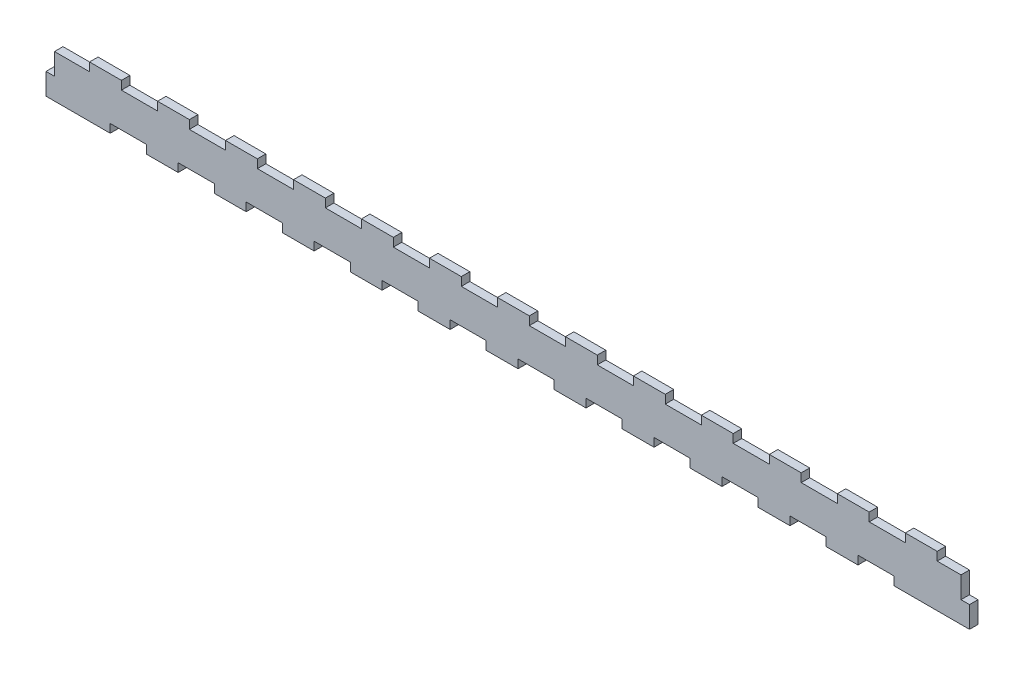
from build123d import *

# Parameters (mm, degrees)
ESQUISSE1_W             = 217.36
ESQUISSE1_H             = 12.11
BOSS_EXTRU_1_DEPTH      = 2
ESQUISSE2_W             = 8.5
ESQUISSE2_H             = 2.25
ESQUISSE2_W_2           = 10.5
ENL_V_MAT_EXTRU_1_DEPTH = 109.866916118
ESQUISSE4_W             = 2
ESQUISSE4_H             = 5.055
ENL_V_MAT_EXTRU_2_DEPTH = 109.866916118


with BuildPart() as part:
    # Esquisse1 → Boss.-Extru.1 (new body)
    with BuildSketch(Plane.XY):
        Rectangle(ESQUISSE1_W, ESQUISSE1_H)
    extrude(amount=BOSS_EXTRU_1_DEPTH)

    # Esquisse2 → Enlèv. mat.-Extru.1 (cut, through all)
    with BuildSketch(Plane(origin=(0, 0, 0), x_dir=(-1, 0, 0), z_dir=(0, 0, -1))):
        with Locations((-105.32, 5.18)):
            Rectangle(ESQUISSE2_W, ESQUISSE2_H)
        with Locations((-89.32, 5.18)):
            Rectangle(ESQUISSE2_W, ESQUISSE2_H)
        with Locations((-73.32, 5.18)):
            Rectangle(ESQUISSE2_W, ESQUISSE2_H)
        with Locations((-57.32, 5.18)):
            Rectangle(ESQUISSE2_W, ESQUISSE2_H)
        with Locations((-41.32, 5.18)):
            Rectangle(ESQUISSE2_W, ESQUISSE2_H)
        with Locations((-25.32, 5.18)):
            Rectangle(ESQUISSE2_W, ESQUISSE2_H)
        with Locations((-9.32, 5.18)):
            Rectangle(ESQUISSE2_W, ESQUISSE2_H)
        with Locations((6.68, 5.18)):
            Rectangle(ESQUISSE2_W, ESQUISSE2_H)
        with Locations((22.68, 5.18)):
            Rectangle(ESQUISSE2_W, ESQUISSE2_H)
        with Locations((38.68, 5.18)):
            Rectangle(ESQUISSE2_W, ESQUISSE2_H)
        with Locations((54.68, 5.18)):
            Rectangle(ESQUISSE2_W, ESQUISSE2_H)
        with Locations((70.68, 5.18)):
            Rectangle(ESQUISSE2_W, ESQUISSE2_H)
        with Locations((86.68, 5.18)):
            Rectangle(ESQUISSE2_W, ESQUISSE2_H)
        with Locations((103.68, 5.18)):
            Rectangle(ESQUISSE2_W_2, ESQUISSE2_H)
        with Locations((-86.68, -5.18)):
            Rectangle(ESQUISSE2_W, ESQUISSE2_H)
        with Locations((-70.68, -5.18)):
            Rectangle(ESQUISSE2_W, ESQUISSE2_H)
        with Locations((-54.68, -5.18)):
            Rectangle(ESQUISSE2_W, ESQUISSE2_H)
        with Locations((-38.68, -5.18)):
            Rectangle(ESQUISSE2_W, ESQUISSE2_H)
        with Locations((-22.68, -5.18)):
            Rectangle(ESQUISSE2_W, ESQUISSE2_H)
        with Locations((-6.68, -5.18)):
            Rectangle(ESQUISSE2_W, ESQUISSE2_H)
        with Locations((9.32, -5.18)):
            Rectangle(ESQUISSE2_W, ESQUISSE2_H)
        with Locations((25.32, -5.18)):
            Rectangle(ESQUISSE2_W, ESQUISSE2_H)
        with Locations((41.32, -5.18)):
            Rectangle(ESQUISSE2_W, ESQUISSE2_H)
        with Locations((57.32, -5.18)):
            Rectangle(ESQUISSE2_W, ESQUISSE2_H)
        with Locations((73.32, -5.18)):
            Rectangle(ESQUISSE2_W, ESQUISSE2_H)
        with Locations((89.32, -5.18)):
            Rectangle(ESQUISSE2_W, ESQUISSE2_H)
    extrude(amount=-ENL_V_MAT_EXTRU_1_DEPTH, mode=Mode.SUBTRACT)

    # Esquisse4 → Enlèv. mat.-Extru.2 (cut, through all)
    with BuildSketch(Plane(origin=(0, 0, 0), x_dir=(-1, 0, 0), z_dir=(0, 0, -1))):
        with Locations((107.68, 1.5275)):
            Rectangle(ESQUISSE4_W, ESQUISSE4_H)
    enl_v_mat_extru_2 = extrude(amount=-ENL_V_MAT_EXTRU_2_DEPTH, mode=Mode.SUBTRACT)

    # Symétrie1: Enlèv. mat.-Extru.2 across plane
    add(enl_v_mat_extru_2.mirror(Plane(origin=(0, 0, 0), x_dir=(0, 0, 1), z_dir=(1, 0, 0))), mode=Mode.SUBTRACT)


solid = part.part
